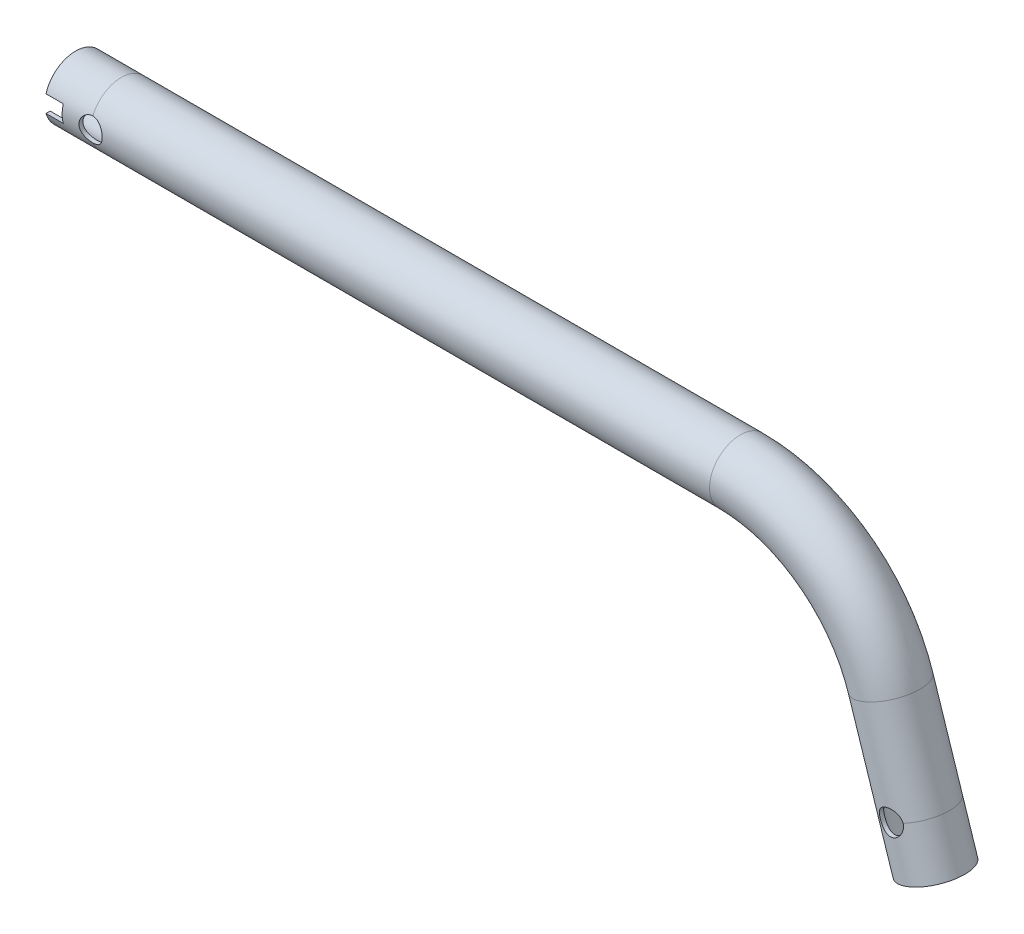
from build123d import *

# Parameters (mm, degrees)
SKETCH2_R                      = 9.25
SKETCH2_R_2                    = 8.05
CUT_EXTRUDE1_REACH             = 267.069
SKETCH3_R                      = 3.6
CUT_EXTRUDE1_DIRECTION_2_REACH = 267.069
CUT_EXTRUDE2_REACH             = 267.069
CUT_EXTRUDE2_END_RADIUS        = 9.25
SKETCH4_R                      = 3.5
CUT_EXTRUDE3_DEPTH             = 266.06934821
CUT_EXTRUDE3_DEPTH_BACK        = 266.06934821


with BuildPart() as part:
    # Sweep1: sweep along a path in Sketch1
    with BuildLine(Plane.XY) as sweep1_path:
        Line((-13.738728062, 0), (0, 0))
        Line((0, 0), (185.994048146, 0))
        ThreePointArc((185.994048146, 0), (213.91384763, -9.071692767), (231.16923267, -32.821692767))
        Line((231.16923267, -32.821692767), (240, -60))
        Line((240, -60), (244.635254916, -74.265847744))
    # Sketch2 → Sweep1 (sweep)
    with BuildSketch(Plane.ZY.offset(13.738728062)):
        Circle(SKETCH2_R)
        Circle(SKETCH2_R_2, mode=Mode.SUBTRACT)
    sweep(path=sweep1_path.line)

    # Sketch3 → Cut-Extrude1 (cut, up to next)
    with BuildSketch(Plane.XY, mode=Mode.PRIVATE) as cut_extrude1_sk1:
        with Locations(Location((240, -60, 0), (0, 0, 18))):
            Circle(SKETCH3_R)
    cut_extrude1_tool1 = extrude(cut_extrude1_sk1.sketch, amount=-CUT_EXTRUDE1_REACH, mode=Mode.PRIVATE) & part.part
    add(cut_extrude1_tool1.solids().sort_by_distance((240, -60, 0))[0], mode=Mode.SUBTRACT)

    # Sketch3 → Cut-Extrude1 direction 2 (cut, up to next)
    with BuildSketch(Plane.XY, mode=Mode.PRIVATE) as cut_extrude1_direction_2_sk1:
        with Locations(Location((240, -60, 0), (0, 0, 18))):
            Circle(SKETCH3_R)
    cut_extrude1_direction_2_tool1 = extrude(cut_extrude1_direction_2_sk1.sketch, amount=CUT_EXTRUDE1_DIRECTION_2_REACH, mode=Mode.PRIVATE) & part.part
    add(cut_extrude1_direction_2_tool1.solids().sort_by_distance((240, -60, 0))[0], mode=Mode.SUBTRACT)

    # Cut-Extrude2: up to this cylinder (the profile starts inside it)
    cut_extrude2_end = Plane(origin=(0, 0, 0), z_dir=(-1, 0, 0)) * Cylinder(CUT_EXTRUDE2_END_RADIUS, 553.638, mode=Mode.PRIVATE)
    # Sketch4 → Cut-Extrude2 (cut, up to the surface)
    with BuildSketch(Plane.XY, mode=Mode.PRIVATE) as cut_extrude2_sk1:
        with Locations(Location((0, 0, 0), (0, 0, 90))):
            Circle(SKETCH4_R)
    cut_extrude2_tool1 = extrude(cut_extrude2_sk1.sketch, amount=CUT_EXTRUDE2_REACH, mode=Mode.PRIVATE) & cut_extrude2_end
    add(cut_extrude2_tool1.solids().sort_by_distance((0, 0, 0))[0], mode=Mode.SUBTRACT)

    # Sketch5 → Cut-Extrude3 (cut, two sides: drawn at the far end of the back side and taken through both)
    with BuildSketch(Plane.XY.offset(-CUT_EXTRUDE3_DEPTH_BACK)):
        Polygon((-13.738728062, 0), (-13.738728062, 2.555), (-8.538728062, 2.555), (-8.538728062, -2.555), (-13.738728062, -2.555), align=None)
    extrude(amount=CUT_EXTRUDE3_DEPTH + CUT_EXTRUDE3_DEPTH_BACK, mode=Mode.SUBTRACT)


solid = part.part
